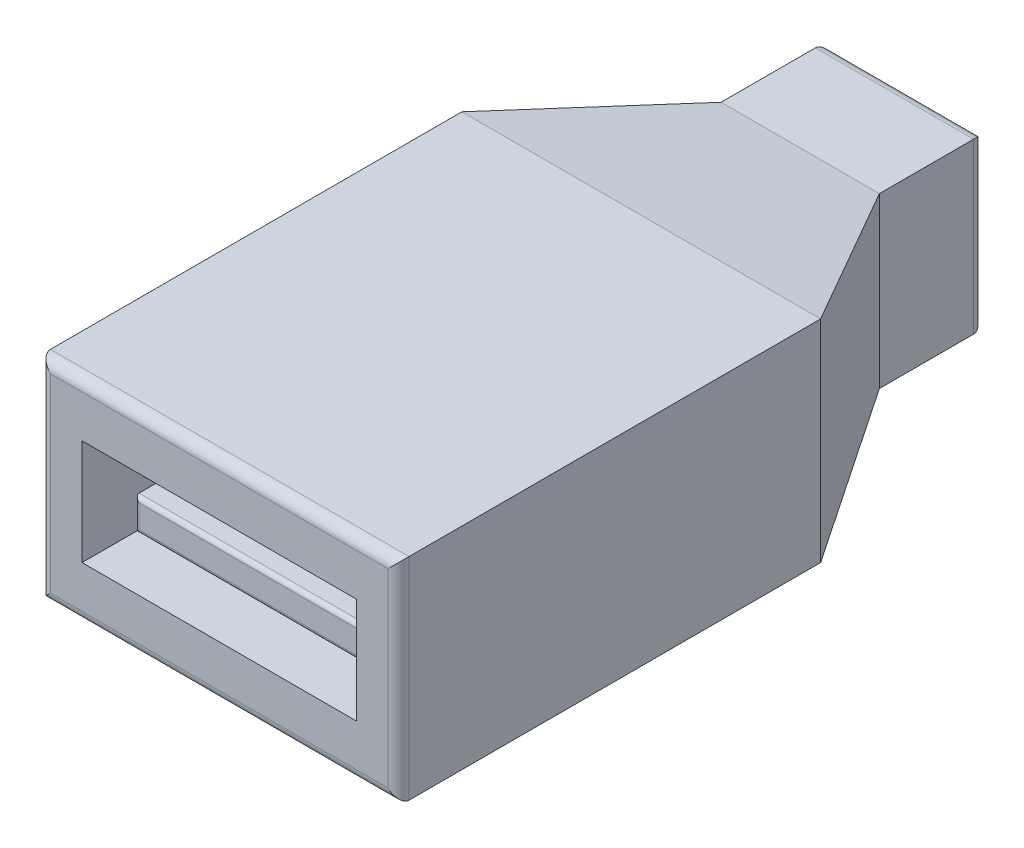
from build123d import *

# Parameters (mm, degrees)
EXTRUDE_1_DEPTH      = 8.5
EXTRUDE_1_DEPTH_BACK = 8.5
CUT_EXTRUDE_3_DEPTH  = 36.049964337
FILLET_3_R           = 0.5
SKETCH_3_W           = 13
SKETCH_3_H           = 5
CUT_EXTRUDE_1_DEPTH  = 15
SKETCH_4_W           = 12
SKETCH_4_H           = 1.5
EXTRUDE_2_DEPTH      = 13
FILLET_2_R           = 0.2


with BuildPart() as part:
    # 草图2 → 凸台-拉伸1 (new, two sides: drawn at the far end of the back side and taken through both)
    with BuildSketch(Plane(origin=(0, 0, 0), x_dir=(0, 0, -1), z_dir=(1, 0, 0)).offset(-EXTRUDE_1_DEPTH_BACK)):
        Polygon((0, -5), (0, 5), (20, 5), (27.532919446, 4), (32.5, 4), (32.5, -4), (27.532919446, -4), (20, -5), align=None)
    extrude(amount=EXTRUDE_1_DEPTH + EXTRUDE_1_DEPTH_BACK)

    # 草图5 → 切除-拉伸3 (cut, through all)
    with BuildSketch(Plane(origin=(0, 5, 0), x_dir=(1, 0, 0), z_dir=(0, 1, 0))):
        Polygon((-3.75, 32.5), (-3.75, 27.532919446), (-8.5, 20), (-8.5, 32.5), align=None)
        Polygon((8.5, 32.5), (3.75, 32.5), (3.75, 27.532919446), (8.5, 20), align=None)
    extrude(amount=-CUT_EXTRUDE_3_DEPTH, mode=Mode.SUBTRACT)

    # 圆角3
    fillet_3_edges = [part.edges().sort_by_distance(p)[0] for p in [
        (0, -5, 0),
        (0, 5, 0),
        (8.5, 0, 0),
        (0, -4, -32.5),
        (0, 4, -32.5),
        (-3.75, 0, -32.5),
        (-8.5, 0, 0),
        (3.75, 0, -32.5),
    ]]
    fillet(fillet_3_edges, radius=FILLET_3_R)

    # 草图3 → 切除-拉伸1 (cut)
    with BuildSketch(Plane.XY):
        Rectangle(SKETCH_3_W, SKETCH_3_H)
    extrude(amount=-CUT_EXTRUDE_1_DEPTH, mode=Mode.SUBTRACT)

    # 草图4 → 凸台-拉伸2 (add)
    with BuildSketch(Plane.XY.offset(-15)):
        with Locations((0, -1.25)):
            Rectangle(SKETCH_4_W, SKETCH_4_H)
    extrude(amount=EXTRUDE_2_DEPTH)

    # 圆角2
    fillet_2_edges = [part.edges().sort_by_distance(p)[0] for p in [
        (0, -0.5, -2),
        (-6, -1.25, -2),
        (0, -2, -2),
        (6, -1.25, -2),
    ]]
    fillet(fillet_2_edges, radius=FILLET_2_R)


solid = part.part
